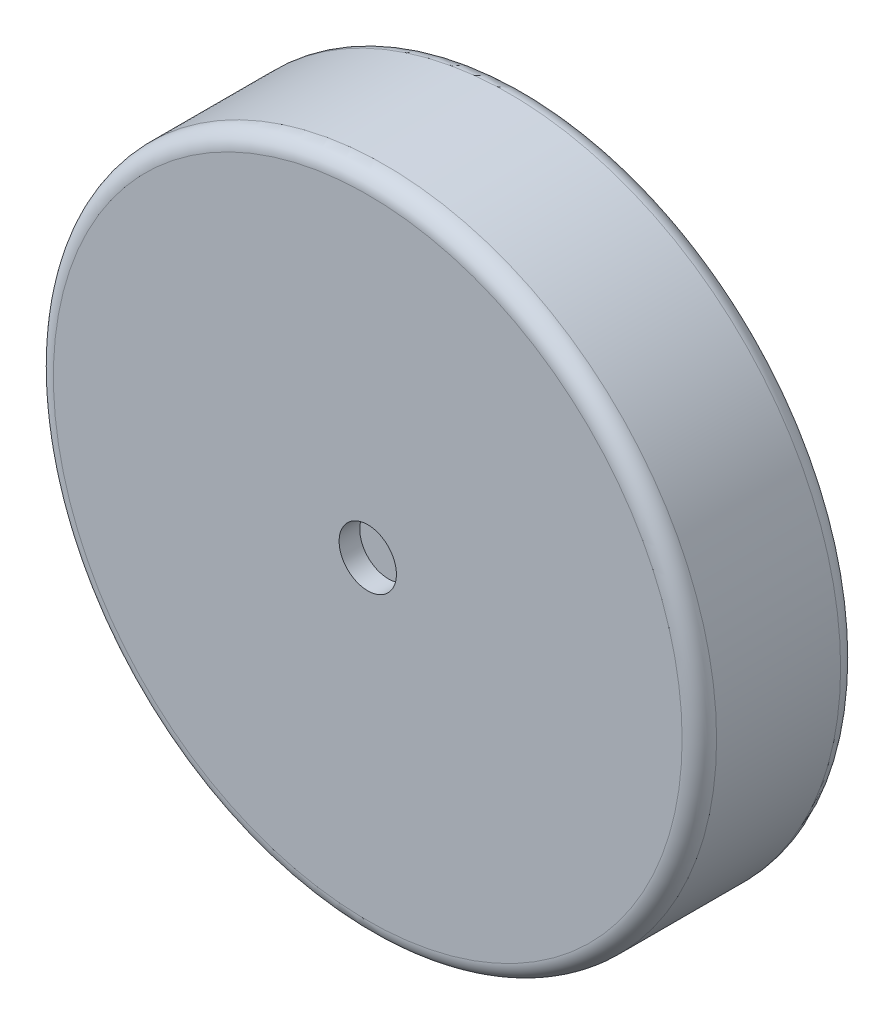
from build123d import *

# Parameters (mm, degrees)
SKETCH1_R           = 48.895
BOSS_EXTRUDE1_DEPTH = 23.368
FILLET1_R           = 2.54
FILLET2_R           = 2.54
SKETCH2_R           = 4.225692655
CUT_EXTRUDE1_DEPTH  = 3.048


with BuildPart() as part:
    # Sketch1 → Boss-Extrude1 (new body)
    with BuildSketch(Plane.XY):
        Circle(SKETCH1_R)
    extrude(amount=BOSS_EXTRUDE1_DEPTH)

    # Fillet1
    fillet1_edges = [part.edges().sort_by_distance(p)[0] for p in [
        (-48.895, 0, 23.368),
    ]]
    fillet(fillet1_edges, radius=FILLET1_R)

    # Fillet2
    fillet2_edges = [part.edges().sort_by_distance(p)[0] for p in [
        (-48.895, 0, 0),
    ]]
    fillet(fillet2_edges, radius=FILLET2_R)

    # Sketch2 → Cut-Extrude1 (cut)
    with BuildSketch(Plane.XY.offset(23.368)):
        Circle(SKETCH2_R)
    extrude(amount=-CUT_EXTRUDE1_DEPTH, mode=Mode.SUBTRACT)


solid = part.part
